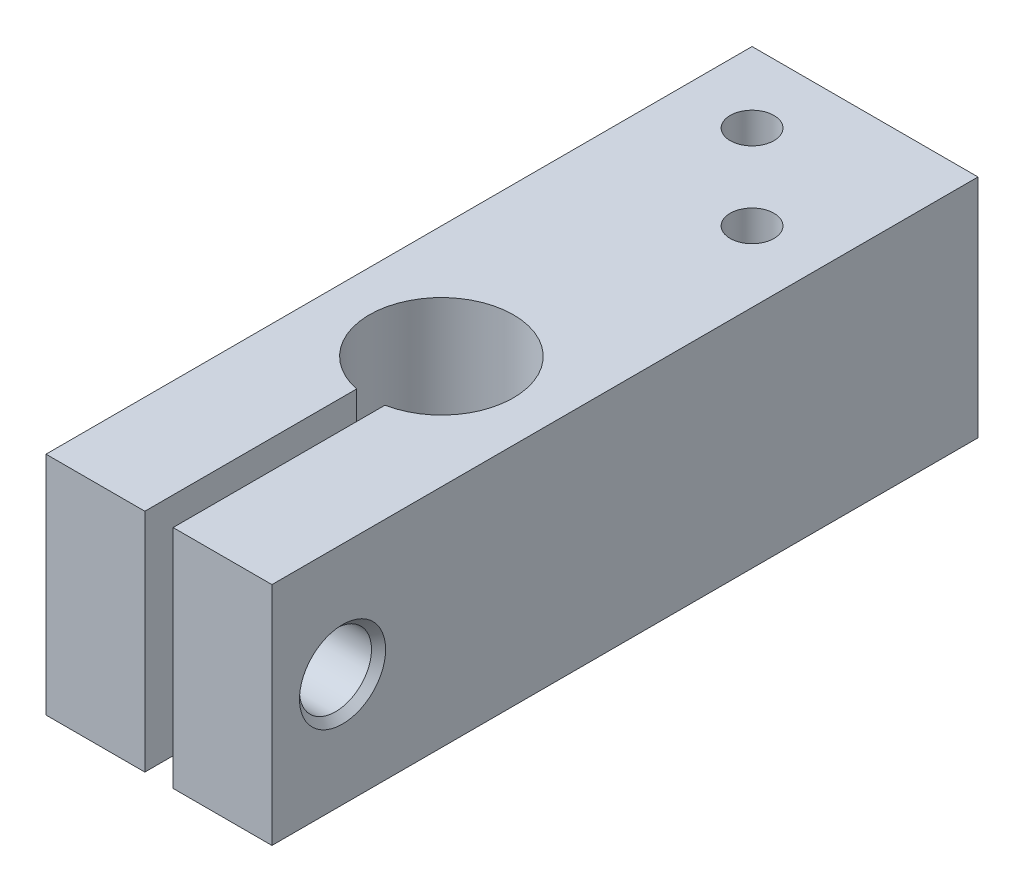
from build123d import *

# Parameters (mm, degrees)
SKETCH1_W                                 = 16
SKETCH1_H                                 = 16
BASE_DEPTH                                = 50
SKETCH2_W                                 = 2
SKETCH2_H                                 = 16
RODSLOT_DEPTH                             = 54.103672189
F_5_1_5_1_FREE_HOLE_FOR_SCREW_D           = 5.1
F_5_1_5_1_FREE_HOLE_FOR_SCREW_DEPTH       = 7.5
F_5_1_5_1_FREE_HOLE_FOR_SCREW_CSINK_D     = 6.1
F_5_1_5_1_FREE_HOLE_FOR_SCREW_CSINK_ANGLE = 90
F_5_1_5_1_FREE_HOLE_FOR_SCREW_TIP         = 1.056244584
M5X0_8_TAPPED_HOLE_FOR_ROD_SCREW_D        = 4.2
M5X0_8_TAPPED_HOLE_FOR_ROD_SCREW_DEPTH    = 7.6381927
M5X0_8_TAPPED_HOLE_FOR_ROD_SCREW_TIP      = 1.2618073
F_3_1_3_1_SCREW_HOLES_D                   = 3.1
F_10_2_10_2_ROD_HOLE_D                    = 10.2


with BuildPart() as part:
    # Sketch1 → Base (new body)
    with BuildSketch(Plane.XY):
        Rectangle(SKETCH1_W, SKETCH1_H)
    extrude(amount=BASE_DEPTH)

    # Sketch2 → RodSlot (cut, through all)
    with BuildSketch(Plane(origin=(0, 8, 0), x_dir=(1, 0, 0), z_dir=(0, 1, 0))):
        with Locations((0, -42)):
            Rectangle(SKETCH2_W, SKETCH2_H)
    extrude(amount=-RODSLOT_DEPTH, mode=Mode.SUBTRACT)

    # Ø5.1 (5.1) free hole for screw
    with Locations(Plane(origin=(8, 0, 0), x_dir=(0, 0, -1), z_dir=(1, 0, 0))):
        with Locations((-45, 0)):
            CounterSinkHole(F_5_1_5_1_FREE_HOLE_FOR_SCREW_D / 2, F_5_1_5_1_FREE_HOLE_FOR_SCREW_CSINK_D / 2, depth=F_5_1_5_1_FREE_HOLE_FOR_SCREW_DEPTH, counter_sink_angle=F_5_1_5_1_FREE_HOLE_FOR_SCREW_CSINK_ANGLE)
            with Locations((0, 0, -(F_5_1_5_1_FREE_HOLE_FOR_SCREW_DEPTH + F_5_1_5_1_FREE_HOLE_FOR_SCREW_TIP / 2))):  # 135° drill point
                Cone(0, F_5_1_5_1_FREE_HOLE_FOR_SCREW_D / 2, F_5_1_5_1_FREE_HOLE_FOR_SCREW_TIP, mode=Mode.SUBTRACT)

    # M5x0.8 Tapped Hole for rod screw
    with Locations(Plane.ZY.offset(8)):
        with Locations((45, 0)):
            Hole(M5X0_8_TAPPED_HOLE_FOR_ROD_SCREW_D / 2, depth=M5X0_8_TAPPED_HOLE_FOR_ROD_SCREW_DEPTH)
            with Locations((0, 0, -(M5X0_8_TAPPED_HOLE_FOR_ROD_SCREW_DEPTH + M5X0_8_TAPPED_HOLE_FOR_ROD_SCREW_TIP / 2))):  # 118° drill point
                Cone(0, M5X0_8_TAPPED_HOLE_FOR_ROD_SCREW_D / 2, M5X0_8_TAPPED_HOLE_FOR_ROD_SCREW_TIP, mode=Mode.SUBTRACT)

    # Ø3.1 (3.1) screw holes (through all)
    with Locations(Plane(origin=(0, -8, 0), x_dir=(-1, 0, 0), z_dir=(0, -1, 0))):
        with Locations((3, -5), (-3, -11)):
            Hole(F_3_1_3_1_SCREW_HOLES_D / 2)

    # Ø10.2 (10.2) Rod Hole (through all)
    with Locations(Plane(origin=(0, 8, 0), x_dir=(1, 0, 0), z_dir=(0, 1, 0))):
        with Locations((0, -30)):
            Hole(F_10_2_10_2_ROD_HOLE_D / 2)


solid = part.part
